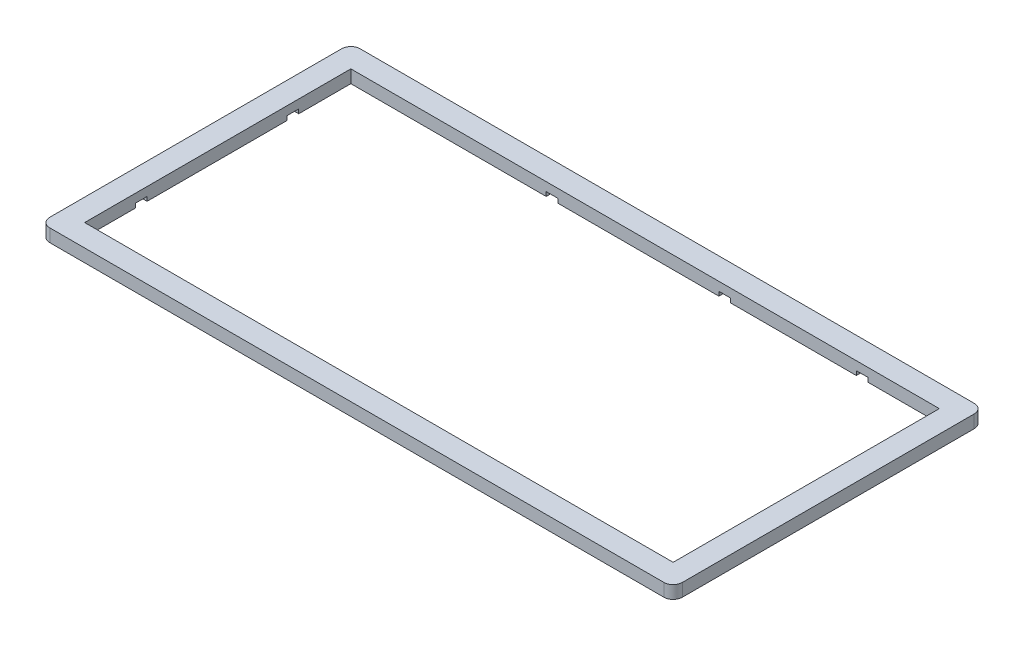
from build123d import *

# Parameters (mm, degrees)
SKETCH1_W           = 344.55
SKETCH1_H           = 169
SKETCH1_W_2         = 320.55
SKETCH1_H_2         = 145
BOSS_EXTRUDE1_DEPTH = 7
FILLET1_R           = 5
FILLET2_R           = 5
FILLET3_R           = 5
CUT_EXTRUDE2_DEPTH  = 2.3
FILLET5_R           = 5
SKETCH4_R           = 1.325
CUT_EXTRUDE3_DEPTH  = 4


with BuildPart() as part:
    # Sketch1 → Boss-Extrude1 (new body)
    with BuildSketch(Plane(origin=(0, 0, 0), x_dir=(1, 0, 0), z_dir=(0, 1, 0))):
        with Locations((0, 6.282475928)):
            Rectangle(SKETCH1_W, SKETCH1_H)
        with Locations((0, 6.282475928)):
            Rectangle(SKETCH1_W_2, SKETCH1_H_2, mode=Mode.SUBTRACT)
    extrude(amount=BOSS_EXTRUDE1_DEPTH)

    # Fillet1
    fillet1_edges = [part.edges().sort_by_distance(p)[0] for p in [
        (172.275, 3.5, 78.217524072),
    ]]
    fillet(fillet1_edges, radius=FILLET1_R)

    # Fillet2
    fillet2_edges = [part.edges().sort_by_distance(p)[0] for p in [
        (-172.275, 3.5, -90.782475928),
    ]]
    fillet(fillet2_edges, radius=FILLET2_R)

    # Fillet3
    fillet3_edges = [part.edges().sort_by_distance(p)[0] for p in [
        (-172.275, 3.5, 78.217524072),
    ]]
    fillet(fillet3_edges, radius=FILLET3_R)

    # Sketch3 → Cut-Extrude2 (cut)
    with BuildSketch(Plane.XZ):
        Polygon((-22.72, -82.082475928), (-47.57, -82.082475928), (-47.57, -78.782475928), (-53.87, -78.782475928), (-53.87, -82.082475928), (-78.72, -82.082475928), (-78.72, -86.582475928), (-22.72, -86.582475928), align=None)
        Polygon((-130.175, 66.217524072), (-123.875, 66.217524072), (-123.875, 69.517524072), (-99.025, 69.517524072), (-99.025, 74.017524072), (-155.025, 74.017524072), (-155.025, 69.517524072), (-130.175, 69.517524072), align=None)
        Polygon((146.225, -82.082475928), (121.375, -82.082475928), (121.375, -78.782475928), (115.075, -78.782475928), (115.075, -82.082475928), (90.225, -82.082475928), (90.225, -86.582475928), (146.225, -86.582475928), align=None)
        Polygon((71.33, -86.582475928), (71.33, -82.082475928), (46.48, -82.082475928), (46.48, -78.782475928), (40.18, -78.782475928), (40.18, -82.082475928), (15.33, -82.082475928), (15.33, -86.582475928), align=None)
        Polygon((-160.275, -44.082475928), (-160.275, -50.382475928), (-163.575, -50.382475928), (-163.575, -75.232475928), (-168.075, -75.232475928), (-168.075, -19.232475928), (-163.575, -19.232475928), (-163.575, -44.082475928), align=None)
        Polygon((163.575, 11.917524072), (163.575, 32.217524072), (160.275, 32.217524072), (160.275, 38.517524072), (163.575, 38.517524072), (163.575, 58.817524072), (168.075, 58.817524072), (168.075, 11.917524072), align=None)
        Polygon((160.275, -40.582475928), (163.575, -40.582475928), (163.575, -15.732475928), (168.075, -15.732475928), (168.075, -71.732475928), (163.575, -71.732475928), (163.575, -46.882475928), (160.275, -46.882475928), align=None)
        Polygon((146.225, 74.017524072), (146.225, 69.517524072), (121.375, 69.517524072), (121.375, 66.217524072), (115.075, 66.217524072), (115.075, 69.517524072), (90.225, 69.517524072), (90.225, 74.017524072), align=None)
        Polygon((15.33, 74.017524072), (71.33, 74.017524072), (71.33, 69.517524072), (46.48, 69.517524072), (46.48, 66.217524072), (40.18, 66.217524072), (40.18, 69.517524072), (15.33, 69.517524072), align=None)
        Polygon((-160.275, 38.517524072), (-160.275, 32.217524072), (-163.575, 32.217524072), (-163.575, 11.917524072), (-168.075, 11.917524072), (-168.075, 58.817524072), (-163.575, 58.817524072), (-163.575, 38.517524072), align=None)
        Polygon((-55.375, 66.217524072), (-49.075, 66.217524072), (-49.075, 69.517524072), (-24.225, 69.517524072), (-24.225, 74.017524072), (-80.225, 74.017524072), (-80.225, 69.517524072), (-55.375, 69.517524072), align=None)
    extrude(amount=-CUT_EXTRUDE2_DEPTH, mode=Mode.SUBTRACT)

    # Fillet5
    fillet5_edges = [part.edges().sort_by_distance(p)[0] for p in [
        (172.275, 3.5, -90.782475928),
    ]]
    fillet(fillet5_edges, radius=FILLET5_R)

    # Sketch4 → Cut-Extrude3 (cut)
    with BuildSketch(Plane.XZ):
        with Locations(Location((-165.542766953, 71.485291024, 0), (0, 0, 270))):
            Circle(SKETCH4_R)
        with Locations(Location((-89.625, 71.767524072, 0), (0, 0, 270))):
            Circle(SKETCH4_R)
        with Locations(Location((80.7775, 71.767524072, 0), (0, 0, 270))):
            Circle(SKETCH4_R)
        with Locations(Location((165.532766953, 71.485291024, 0), (0, 0, 270))):
            Circle(SKETCH4_R)
        with Locations(Location((165.532766953, -84.050242881, 0), (0, 0, 270))):
            Circle(SKETCH4_R)
        with Locations(Location((80.7775, -84.332475928, 0), (0, 0, 270))):
            Circle(SKETCH4_R)
        with Locations(Location((-89.625, -84.050242881, 0), (0, 0, 270))):
            Circle(SKETCH4_R)
        with Locations(Location((-165.542766953, -84.050242881, 0), (0, 0, 270))):
            Circle(SKETCH4_R)
    extrude(amount=-CUT_EXTRUDE3_DEPTH, mode=Mode.SUBTRACT)


solid = part.part
